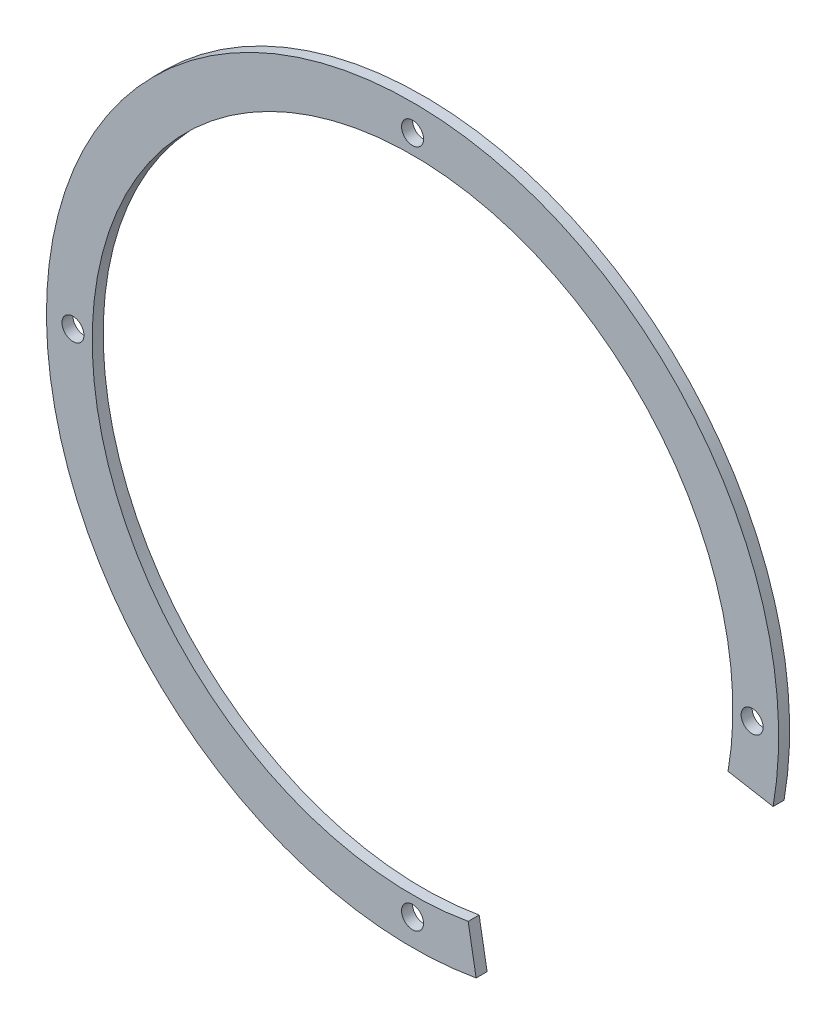
from build123d import *

# Parameters (mm, degrees)
SKETCH_1_R          = 100
SKETCH_1_R_2        = 87.5
SKETCH_1_R_3        = 3
EXTRUDE_1_DEPTH     = 3
CUT_EXTRUDE_1_DEPTH = 142.453172464


with BuildPart() as part:
    # 草图1 → 凸台-拉伸1 (new body)
    with BuildSketch(Plane.XY):
        Circle(SKETCH_1_R)
        Circle(SKETCH_1_R_2, mode=Mode.SUBTRACT)
        with Locations((0, 92.75)):
            Circle(SKETCH_1_R_3, mode=Mode.SUBTRACT)
        with Locations((92.75, 0)):
            Circle(SKETCH_1_R_3, mode=Mode.SUBTRACT)
        with Locations((0, -92.75)):
            Circle(SKETCH_1_R_3, mode=Mode.SUBTRACT)
        with Locations((-92.75, 0)):
            Circle(SKETCH_1_R_3, mode=Mode.SUBTRACT)
    extrude(amount=EXTRUDE_1_DEPTH)

    # 草图2 → 切除-拉伸1 (cut, through all)
    with BuildSketch(Plane.XY.offset(3)):
        with BuildLine():
            ThreePointArc((86.170678389, -15.194215546), (61.871843354, -61.871843354), (15.194215546, -86.170678389))
            Line((15.194215546, -86.170678389), (17.364817767, -98.480775301))
            ThreePointArc((17.364817767, -98.480775301), (70.710678119, -70.710678119), (98.480775301, -17.364817767))
            Line((98.480775301, -17.364817767), (86.170678389, -15.194215546))
        make_face()
    extrude(amount=-CUT_EXTRUDE_1_DEPTH, mode=Mode.SUBTRACT)


solid = part.part
